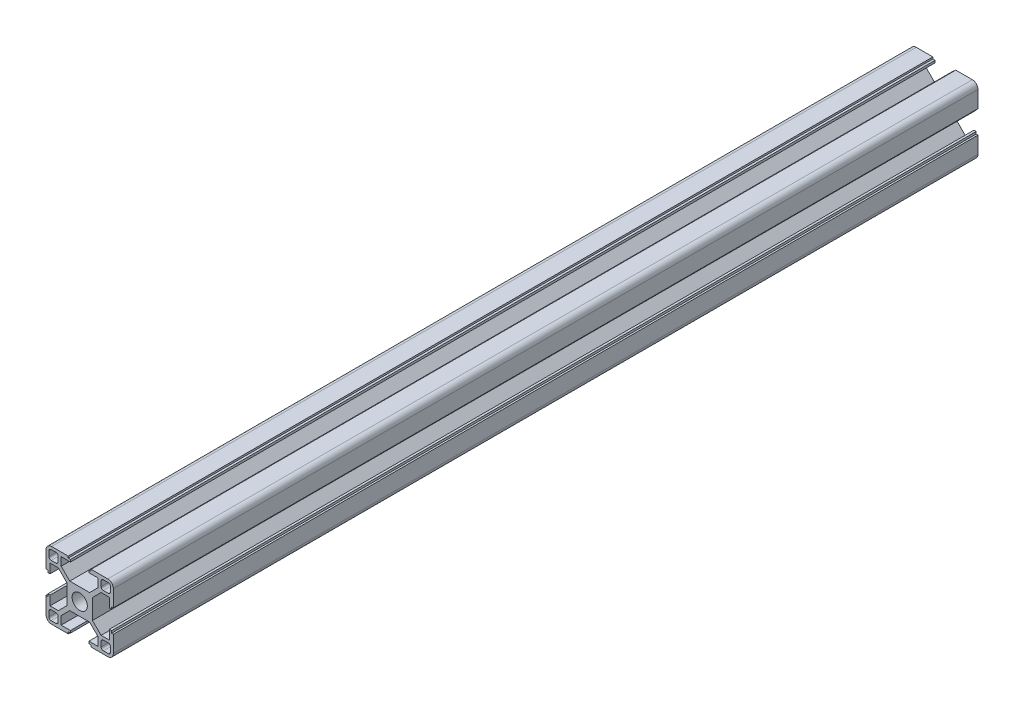
from build123d import *

# Parameters (mm, degrees)
SKETCH1_R      = 3.4
EXTRUDE1_DEPTH = 385
EXTRUDE2_DEPTH = 386.583972696


with BuildPart() as part:
    # Sketch1 → Extrude1 (new body)
    with BuildSketch(Plane.XY):
        with BuildLine():
            Line((-5.1, 14.2), (-5.1, 15))
            Line((-5.1, 15), (-12.5, 15))
            ThreePointArc((-12.5, 15), (-14.267766953, 14.267766953), (-15, 12.5))
            Line((-15, 12.5), (-15, 5.1))
            Line((-15, 5.1), (-14.2, 5.1))
            Line((-14.2, 5.1), (-14.2, 4.1))
            Line((-14.2, 4.1), (-13.2, 4.1))
            Line((-13.2, 4.1), (-13.2, 8.25))
            Line((-13.2, 8.25), (-9.522792206, 8.25))
            Line((-9.522792206, 8.25), (-5.7, 4.427207794))
            Line((-5.7, 4.427207794), (-5.7, -4.427207794))
            Line((-5.7, -4.427207794), (-9.522792206, -8.25))
            Line((-9.522792206, -8.25), (-13.2, -8.25))
            Line((-13.2, -8.25), (-13.2, -4.1))
            Line((-13.2, -4.1), (-14.2, -4.1))
            Line((-14.2, -4.1), (-14.2, -5.1))
            Line((-14.2, -5.1), (-15, -5.1))
            Line((-15, -5.1), (-15, -12.5))
            ThreePointArc((-15, -12.5), (-14.267766953, -14.267766953), (-12.5, -15))
            Line((-12.5, -15), (-5.1, -15))
            Line((-5.1, -15), (-5.1, -14.2))
            Line((-5.1, -14.2), (-4.1, -14.2))
            Line((-4.1, -14.2), (-4.1, -13.2))
            Line((-4.1, -13.2), (-8.25, -13.2))
            Line((-8.25, -13.2), (-8.25, -9.522792206))
            Line((-8.25, -9.522792206), (-4.427207794, -5.7))
            Line((-4.427207794, -5.7), (4.427207794, -5.7))
            Line((4.427207794, -5.7), (8.25, -9.522792206))
            Line((8.25, -9.522792206), (8.25, -13.2))
            Line((8.25, -13.2), (4.1, -13.2))
            Line((4.1, -13.2), (4.1, -14.2))
            Line((4.1, -14.2), (5.1, -14.2))
            Line((5.1, -14.2), (5.1, -15))
            Line((5.1, -15), (12.5, -15))
            ThreePointArc((12.5, -15), (14.267766953, -14.267766953), (15, -12.5))
            Line((15, -12.5), (15, -5.1))
            Line((15, -5.1), (14.2, -5.1))
            Line((14.2, -5.1), (14.2, -4.1))
            Line((14.2, -4.1), (13.2, -4.1))
            Line((13.2, -4.1), (13.2, -8.25))
            Line((13.2, -8.25), (9.522792206, -8.25))
            Line((9.522792206, -8.25), (5.7, -4.427207794))
            Line((5.7, -4.427207794), (5.7, 4.427207794))
            Line((5.7, 4.427207794), (9.522792206, 8.25))
            Line((9.522792206, 8.25), (13.2, 8.25))
            Line((13.2, 8.25), (13.2, 4.1))
            Line((13.2, 4.1), (14.2, 4.1))
            Line((14.2, 4.1), (14.2, 5.1))
            Line((14.2, 5.1), (15, 5.1))
            Line((15, 5.1), (15, 12.5))
            ThreePointArc((15, 12.5), (14.267766953, 14.267766953), (12.5, 15))
            Line((12.5, 15), (5.1, 15))
            Line((5.1, 15), (5.1, 14.2))
            Line((5.1, 14.2), (4.1, 14.2))
            Line((4.1, 14.2), (4.1, 13.2))
            Line((4.1, 13.2), (8.25, 13.2))
            Line((8.25, 13.2), (8.25, 9.522792206))
            Line((8.25, 9.522792206), (4.427207794, 5.7))
            Line((4.427207794, 5.7), (-4.427207794, 5.7))
            Line((-4.427207794, 5.7), (-8.25, 9.522792206))
            Line((-8.25, 9.522792206), (-8.25, 13.2))
            Line((-8.25, 13.2), (-4.1, 13.2))
            Line((-4.1, 13.2), (-4.1, 14.2))
            Line((-4.1, 14.2), (-5.1, 14.2))
        make_face()
        Circle(SKETCH1_R, mode=Mode.SUBTRACT)
    extrude(amount=EXTRUDE1_DEPTH)

    # Sketch2 → Extrude2 (cut, through all)
    with BuildSketch(Plane.XY.offset(385)):
        with BuildLine():
            Line((13.7, 12.7), (13.7, 10.55))
            ThreePointArc((13.7, 10.55), (13.407106781, 9.842893219), (12.7, 9.55))
            Line((12.7, 9.55), (10.55, 9.55))
            ThreePointArc((10.55, 9.55), (9.842893219, 9.842893219), (9.55, 10.55))
            Line((9.55, 10.55), (9.55, 12.7))
            ThreePointArc((9.55, 12.7), (9.842893219, 13.407106781), (10.55, 13.7))
            Line((10.55, 13.7), (12.7, 13.7))
            ThreePointArc((12.7, 13.7), (13.407106781, 13.407106781), (13.7, 12.7))
        make_face()
        with BuildLine():
            Line((-12.7, 13.7), (-10.55, 13.7))
            ThreePointArc((-10.55, 13.7), (-9.842893219, 13.407106781), (-9.55, 12.7))
            Line((-9.55, 12.7), (-9.55, 10.55))
            ThreePointArc((-9.55, 10.55), (-9.842893219, 9.842893219), (-10.55, 9.55))
            Line((-10.55, 9.55), (-12.7, 9.55))
            ThreePointArc((-12.7, 9.55), (-13.407106781, 9.842893219), (-13.7, 10.55))
            Line((-13.7, 10.55), (-13.7, 12.7))
            ThreePointArc((-13.7, 12.7), (-13.407106781, 13.407106781), (-12.7, 13.7))
        make_face()
        with BuildLine():
            Line((12.7, -13.7), (10.55, -13.7))
            ThreePointArc((10.55, -13.7), (9.842893219, -13.407106781), (9.55, -12.7))
            Line((9.55, -12.7), (9.55, -10.55))
            ThreePointArc((9.55, -10.55), (9.842893219, -9.842893219), (10.55, -9.55))
            Line((10.55, -9.55), (12.7, -9.55))
            ThreePointArc((12.7, -9.55), (13.407106781, -9.842893219), (13.7, -10.55))
            Line((13.7, -10.55), (13.7, -12.7))
            ThreePointArc((13.7, -12.7), (13.407106781, -13.407106781), (12.7, -13.7))
        make_face()
        with BuildLine():
            Line((-13.7, -12.7), (-13.7, -10.55))
            ThreePointArc((-13.7, -10.55), (-13.407106781, -9.842893219), (-12.7, -9.55))
            Line((-12.7, -9.55), (-10.55, -9.55))
            ThreePointArc((-10.55, -9.55), (-9.842893219, -9.842893219), (-9.55, -10.55))
            Line((-9.55, -10.55), (-9.55, -12.7))
            ThreePointArc((-9.55, -12.7), (-9.842893219, -13.407106781), (-10.55, -13.7))
            Line((-10.55, -13.7), (-12.7, -13.7))
            ThreePointArc((-12.7, -13.7), (-13.407106781, -13.407106781), (-13.7, -12.7))
        make_face()
    extrude(amount=-EXTRUDE2_DEPTH, mode=Mode.SUBTRACT)


solid = part.part
